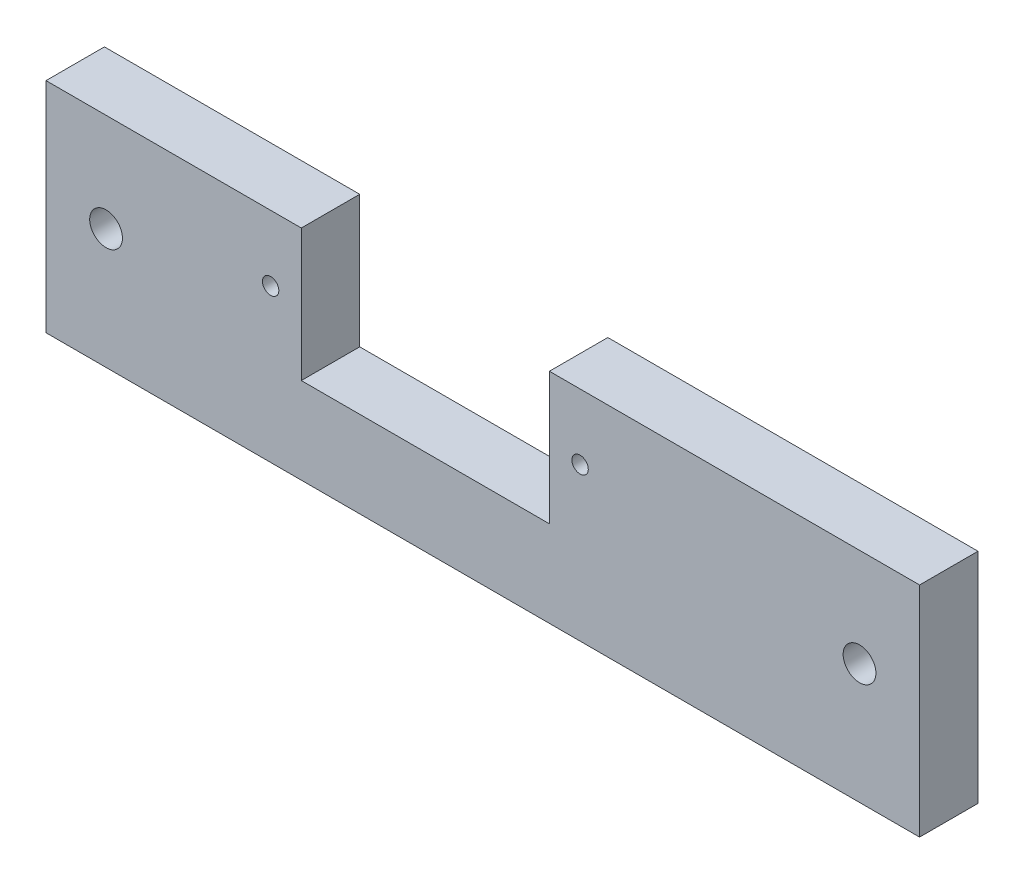
from build123d import *

# Parameters (mm, degrees)
MODEL_R             = 1.5
MODEL_R_2           = 0.75
BOSS_EXTRUDE1_DEPTH = 5.35


with BuildPart() as part:
    # Model → Boss-Extrude1 (new body)
    with BuildSketch(Plane.XY):
        Polygon((46.1, 20), (80, 20), (80, 0), (0, 0), (0, 20), (23.38, 20), (23.38, 7.9), (46.1, 7.9), align=None)
        with Locations((74.5, 11)):
            Circle(MODEL_R, mode=Mode.SUBTRACT)
        with Locations((5.5, 11)):
            Circle(MODEL_R, mode=Mode.SUBTRACT)
        with Locations((20.57, 14)):
            Circle(MODEL_R_2, mode=Mode.SUBTRACT)
        with Locations((48.91, 14)):
            Circle(MODEL_R_2, mode=Mode.SUBTRACT)
    extrude(amount=BOSS_EXTRUDE1_DEPTH)


solid = part.part
